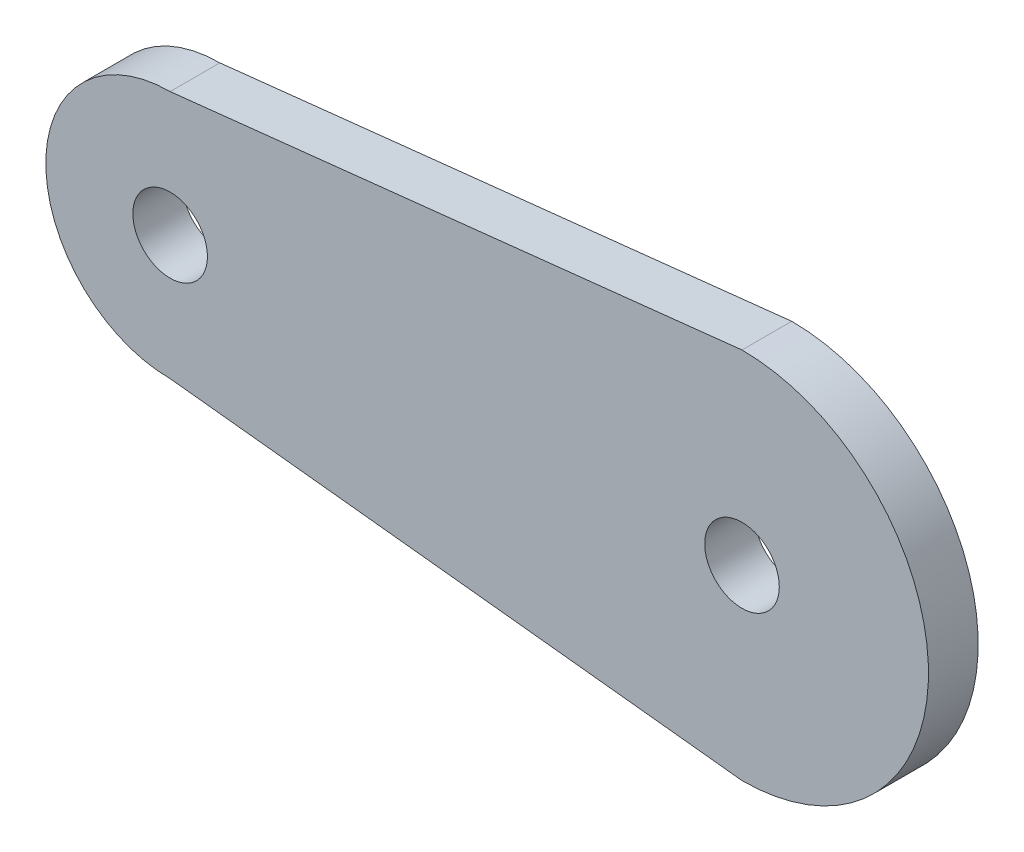
from build123d import *

# Parameters (mm, degrees)
SKETCH1_R           = 1.5
BOSS_EXTRUDE1_DEPTH = 16
SKETCH3_W           = 48.560524615
SKETCH3_H           = 12
CUT_EXTRUDE1_DEPTH  = 38.566607513
SKETCH4_W           = 40.711523195
SKETCH4_H           = 24.869533466
CUT_EXTRUDE2_DEPTH  = 10


with BuildPart() as part:
    # Sketch1 → Boss-Extrude1 (new body)
    with BuildSketch(Plane.XY):
        with BuildLine():
            ThreePointArc((23, 7.5), (30.5, 0), (23, -7.5))
            Line((23, -7.5), (0, -5))
            ThreePointArc((0, -5), (-5, 0), (0, 5))
            Line((0, 5), (23, 7.5))
        make_face()
        with Locations((23, 0)):
            Circle(SKETCH1_R, mode=Mode.SUBTRACT)
        Circle(SKETCH1_R, mode=Mode.SUBTRACT)
    extrude(amount=BOSS_EXTRUDE1_DEPTH)

    # Sketch3 → Cut-Extrude1 (cut, through all)
    with BuildSketch(Plane(origin=(0, 7.5, 0), x_dir=(1, 0, 0), z_dir=(0, 1, 0))):
        with Locations((17.305581285, -8)):
            Rectangle(SKETCH3_W, SKETCH3_H)
    extrude(amount=-CUT_EXTRUDE1_DEPTH, mode=Mode.SUBTRACT)


with BuildPart() as cut_extrude1_piece_1:
    # of the separate pieces the step leaves, piece 1, a body of its own (cut_extrude1_pieces)
    add(part.part.solids().sort_by_distance((0, 5, 0))[0])

    # Sketch4 → Cut-Extrude2 (cut)
    with BuildSketch(Plane(origin=(0, 0, 0), x_dir=(-1, 0, 0), z_dir=(0, 0, -1))):
        with Locations((-12.191435823, 3.299568453)):
            Rectangle(SKETCH4_W, SKETCH4_H)
    extrude(amount=-CUT_EXTRUDE2_DEPTH, mode=Mode.SUBTRACT)


with BuildPart() as cut_extrude1_piece_2:
    # of the separate pieces the step leaves, piece 2, a body of its own (cut_extrude1_pieces)
    add(part.part.solids().sort_by_distance((0, 5, 14))[0])


solid = cut_extrude1_piece_2.part
